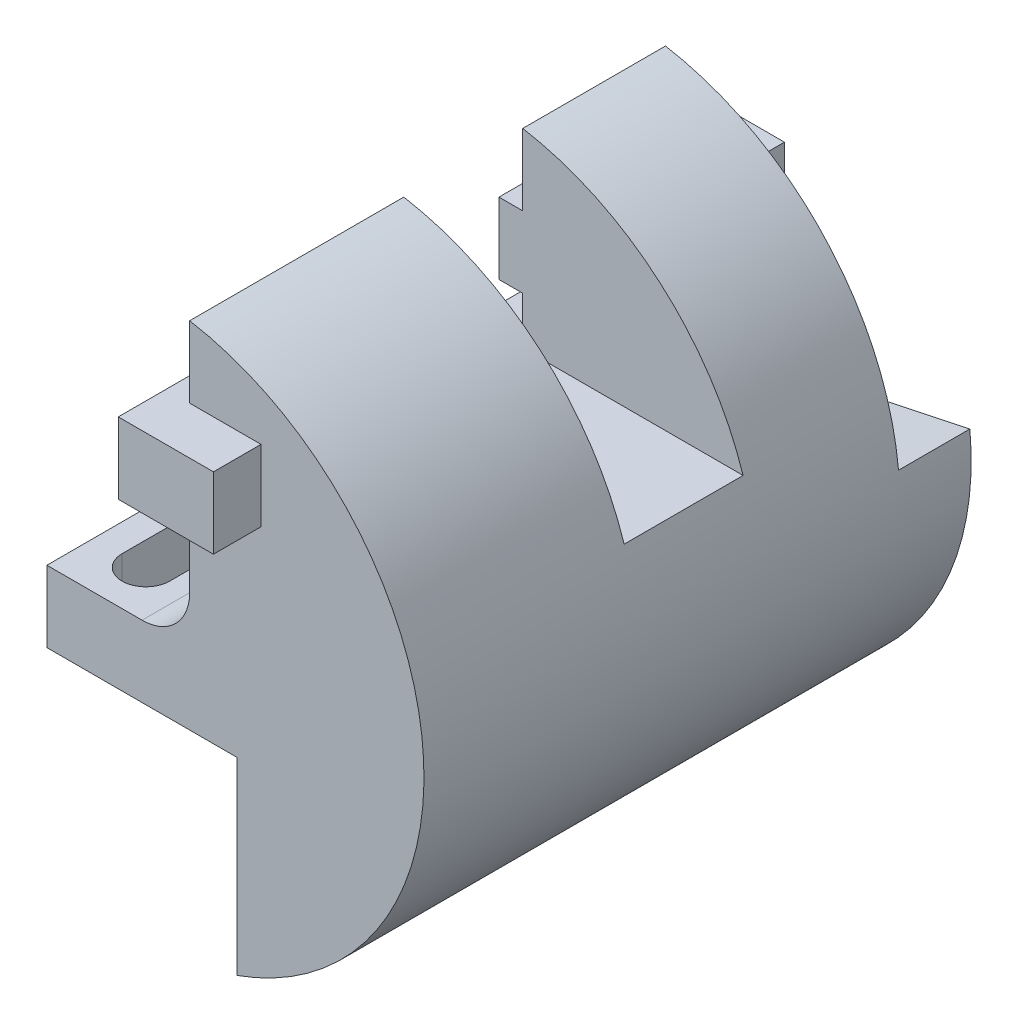
from build123d import *

# Parameters (mm, degrees)
BOSS_EXTRU_1_DEPTH           = 100
ESQUISSE2_W                  = 20
ESQUISSE2_H                  = 15
BOSS_EXTRU_2_DEPTH           = 10
ESQUISSE3_W                  = 20
ESQUISSE3_H                  = 15
BOSS_EXTRU_3_DEPTH           = 10
ENL_V_MAT_EXTRU_1_DEPTH      = 136.844120226
ENL_V_MAT_EXTRU_1_DEPTH_BACK = 136.844120226
ESQUISSE4_W                  = 25
ESQUISSE4_H                  = 59.035199706
BOSS_EXTRU_4_START           = 15
BOSS_EXTRU_4_DEPTH           = 15
ENL_V_MAT_EXTRU_2_DEPTH      = 139.386460682
ENL_V_MAT_EXTRU_2_DEPTH_BACK = 139.386460682


with BuildPart() as part:
    # Esquisse1 → Boss.-Extru.1 (new body)
    with BuildSketch(Plane.XY):
        with BuildLine():
            Line((-20, -1.099978596), (0, -1.099978596))
            ThreePointArc((0, -1.099978596), (7.071067812, 1.828953592), (10, 8.900021404))
            Line((10, 8.900021404), (10, 28.400021404))
            Line((10, 28.400021404), (5, 28.400021404))
            Line((5, 28.400021404), (5, 43.400021404))
            Line((5, 43.400021404), (10, 43.400021404))
            Line((10, 43.400021404), (10, 58.400021404))
            ThreePointArc((10, 58.400021404), (59.024032595, 5.169726898), (20, -55.772417018))
            Line((20, -55.772417018), (20, -16.099978596))
            Line((20, -16.099978596), (-20, -16.099978596))
            Line((-20, -16.099978596), (-20, -1.099978596))
        make_face()
    extrude(amount=BOSS_EXTRU_1_DEPTH)

    # Esquisse2 → Boss.-Extru.2 (add)
    with BuildSketch(Plane.XY.offset(100)):
        with Locations((15, 35.900021404)):
            Rectangle(ESQUISSE2_W, ESQUISSE2_H)
    extrude(amount=BOSS_EXTRU_2_DEPTH)

    # Esquisse3 → Boss.-Extru.3 (add)
    with BuildSketch(Plane(origin=(0, 0, 0), x_dir=(-1, 0, 0), z_dir=(0, 0, -1))):
        with Locations((-15, 35.900021404)):
            Rectangle(ESQUISSE3_W, ESQUISSE3_H)
    extrude(amount=BOSS_EXTRU_3_DEPTH)

    # Esquisse4 → Enlèv. mat.-Extru.1 (cut, two sides: drawn at the far end of the back side and taken through both)
    with BuildSketch(Plane.ZY.offset(-5).offset(-ENL_V_MAT_EXTRU_1_DEPTH_BACK)):
        with Locations((42.5, 47.917621257)):
            Rectangle(ESQUISSE4_W, ESQUISSE4_H)
    extrude(amount=ENL_V_MAT_EXTRU_1_DEPTH + ENL_V_MAT_EXTRU_1_DEPTH_BACK, mode=Mode.SUBTRACT)

    # Esquisse5 → Boss.-Extru.4 (add)
    with BuildSketch(Plane(origin=(0, 0, 0), x_dir=(-1, 0, 0), z_dir=(0, 0, -1)).offset(BOSS_EXTRU_4_START)):
        with BuildLine():
            Line((20, -16.099978596), (20, -11.099978596))
            Line((20, -11.099978596), (-58.976442171, 5.686982405))
            ThreePointArc((-58.976442171, 5.686982405), (-50.036327292, -31.732135938), (-20, -55.772417018))
            Line((-20, -55.772417018), (-20, -16.099978596))
            Line((-20, -16.099978596), (20, -16.099978596))
        make_face()
    extrude(amount=-BOSS_EXTRU_4_DEPTH)

    # Esquisse6 → Enlèv. mat.-Extru.2 (cut, two sides: drawn at the far end of the back side and taken through both)
    with BuildSketch(Plane(origin=(0, -1.099978596, 0), x_dir=(1, 0, 0), z_dir=(0, 1, 0)).offset(-ENL_V_MAT_EXTRU_2_DEPTH_BACK)):
        with BuildLine():
            Line((-4.201981332, -10), (-4.201981332, -90))
            ThreePointArc((-4.201981332, -90), (-9.201981332, -95), (-14.201981332, -90))
            Line((-14.201981332, -90), (-14.201981332, -10))
            ThreePointArc((-14.201981332, -10), (-9.201981332, -5), (-4.201981332, -10))
        make_face()
    extrude(amount=ENL_V_MAT_EXTRU_2_DEPTH + ENL_V_MAT_EXTRU_2_DEPTH_BACK, mode=Mode.SUBTRACT)


solid = part.part
